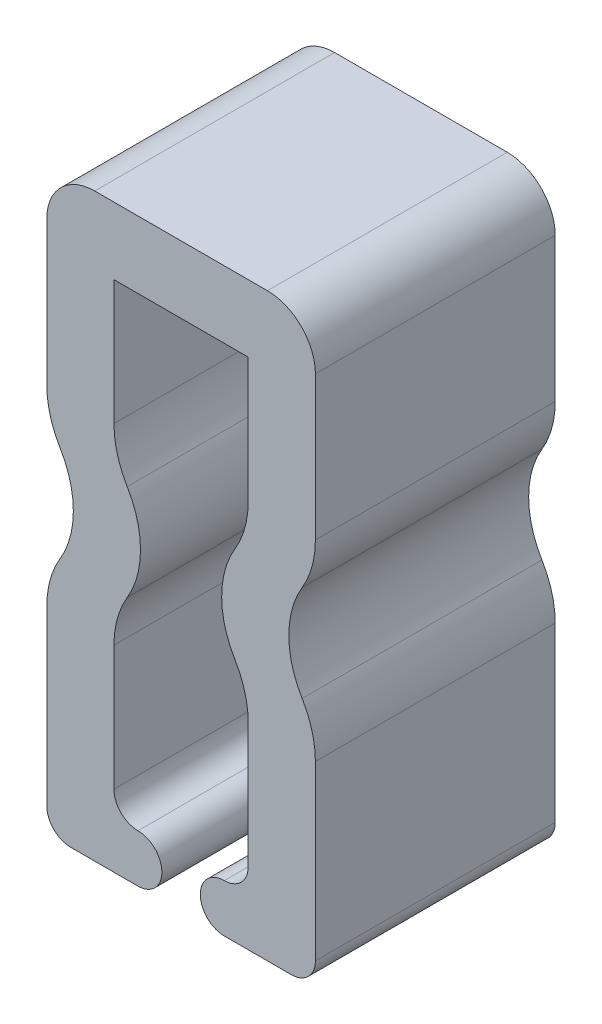
from build123d import *

# Parameters (mm, degrees)
BOSS_EXTRUDE1_DEPTH = 5


with BuildPart() as part:
    # Sketch2 → Boss-Extrude1 (new body)
    with BuildSketch(Plane.XY):
        with BuildLine():
            Line((-1.4, 7.8), (1.4, 7.8))
            Line((1.4, 7.8), (1.4, 5.2))
            ThreePointArc((1.4, 5.2), (1.329474497, 4.681174375), (1.123016035, 4.2))
            ThreePointArc((1.123016035, 4.2), (0.84603207, 3.2), (1.123016035, 2.2))
            ThreePointArc((1.123016035, 2.2), (1.329474497, 1.718825625), (1.4, 1.2))
            Line((1.4, 1.2), (1.4, -1.4))
            ThreePointArc((1.4, -1.4), (1.253553391, -1.753553391), (0.9, -1.9))
            ThreePointArc((0.9, -1.9), (0.546446609, -2.046446609), (0.4, -2.4))
            ThreePointArc((0.4, -2.4), (0.546446609, -2.753553391), (0.9, -2.9))
            Line((0.9, -2.9), (2.3, -2.9))
            ThreePointArc((2.3, -2.9), (2.653553391, -2.753553391), (2.8, -2.4))
            Line((2.8, -2.4), (2.8, 1.2))
            ThreePointArc((2.8, 1.2), (2.729474497, 1.718825625), (2.523016035, 2.2))
            ThreePointArc((2.523016035, 2.2), (2.24603207, 3.2), (2.523016035, 4.2))
            ThreePointArc((2.523016035, 4.2), (2.729474497, 4.681174375), (2.8, 5.2))
            Line((2.8, 5.2), (2.8, 8.2))
            ThreePointArc((2.8, 8.2), (2.507106781, 8.907106781), (1.8, 9.2))
            Line((1.8, 9.2), (-1.8, 9.2))
            ThreePointArc((-1.8, 9.2), (-2.507106781, 8.907106781), (-2.8, 8.2))
            Line((-2.8, 8.2), (-2.8, 5.2))
            ThreePointArc((-2.8, 5.2), (-2.729474497, 4.681174375), (-2.523016035, 4.2))
            ThreePointArc((-2.523016035, 4.2), (-2.24603207, 3.2), (-2.523016035, 2.2))
            ThreePointArc((-2.523016035, 2.2), (-2.729474497, 1.718825625), (-2.8, 1.2))
            Line((-2.8, 1.2), (-2.8, -2.4))
            ThreePointArc((-2.8, -2.4), (-2.653553391, -2.753553391), (-2.3, -2.9))
            Line((-2.3, -2.9), (-0.9, -2.9))
            ThreePointArc((-0.9, -2.9), (-0.546446609, -2.753553391), (-0.4, -2.4))
            ThreePointArc((-0.4, -2.4), (-0.546446609, -2.046446609), (-0.9, -1.9))
            ThreePointArc((-0.9, -1.9), (-1.253553391, -1.753553391), (-1.4, -1.4))
            Line((-1.4, -1.4), (-1.4, 1.2))
            ThreePointArc((-1.4, 1.2), (-1.329474497, 1.718825625), (-1.123016035, 2.2))
            ThreePointArc((-1.123016035, 2.2), (-0.84603207, 3.2), (-1.123016035, 4.2))
            ThreePointArc((-1.123016035, 4.2), (-1.329474497, 4.681174375), (-1.4, 5.2))
            Line((-1.4, 5.2), (-1.4, 7.8))
        make_face()
    extrude(amount=BOSS_EXTRUDE1_DEPTH)


solid = part.part
